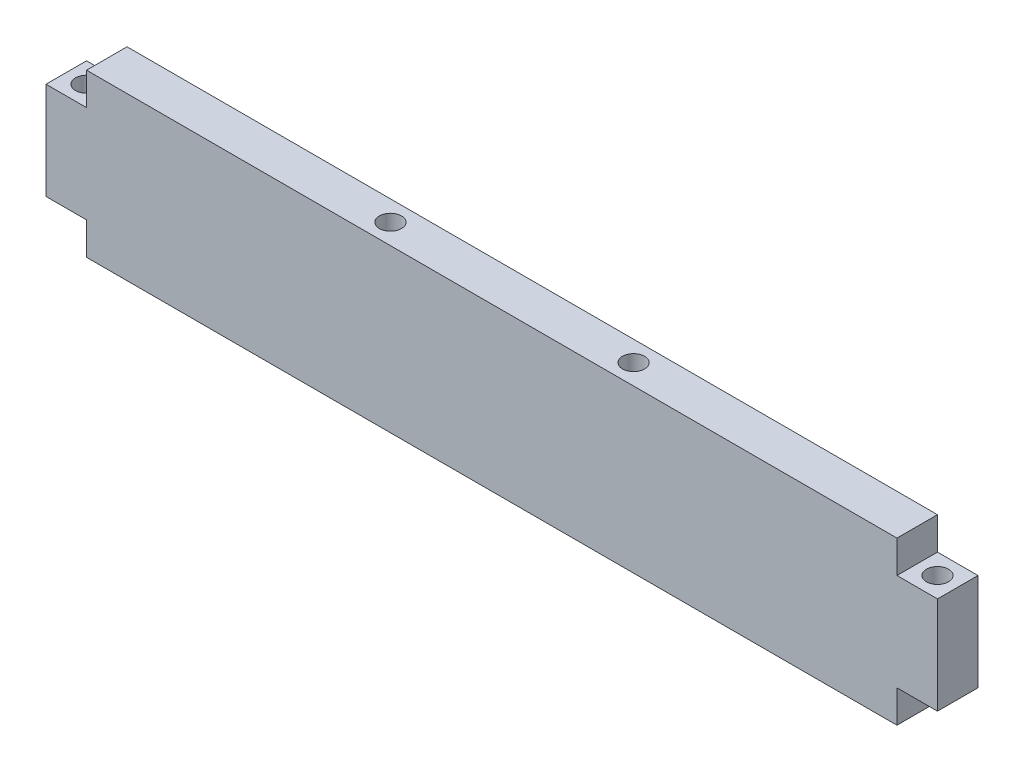
from build123d import *

# Parameters (mm, degrees)
SKETCH1_W                          = 139.7
SKETCH1_H                          = 25.4
BOSS_EXTRUDE1_DEPTH                = 3.175
CUT_EXTRUDE1_REACH                 = 73.279
SKETCH2_W                          = 6.35
SKETCH2_H                          = 5.08
TAP_DRILL_FOR_8_32_TAP1_AT_2_COUNT = 2
TAP_DRILL_FOR_8_32_TAP1_AT_2_PITCH = 47.625
TAP_DRILL_FOR_8_32_TAP1_AT_3_COUNT = 2
TAP_DRILL_FOR_8_32_TAP1_AT_3_PITCH = 85.725
TAP_DRILL_FOR_8_32_TAP1_AT_4_COUNT = 2
TAP_DRILL_FOR_8_32_TAP1_AT_4_PITCH = 133.35


with BuildPart() as part:
    # Sketch1 → Boss-Extrude1 (new, symmetric)
    with BuildSketch(Plane.XY):
        Rectangle(SKETCH1_W, SKETCH1_H)
    extrude(amount=BOSS_EXTRUDE1_DEPTH, both=True)

    # Sketch2 → Cut-Extrude1 (cut, up to next)
    with BuildSketch(Plane.XY.offset(3.175), mode=Mode.PRIVATE) as cut_extrude1_sk1:
        with Locations((-66.675, 10.16)):
            Rectangle(SKETCH2_W, SKETCH2_H)
    cut_extrude1_tool1 = extrude(cut_extrude1_sk1.sketch, amount=-CUT_EXTRUDE1_REACH, mode=Mode.PRIVATE) & part.part
    # Sketch2 → Cut-Extrude1 (cut, up to next)
    with BuildSketch(Plane.XY.offset(3.175), mode=Mode.PRIVATE) as cut_extrude1_sk2:
        with Locations((-66.675, -10.16)):
            Rectangle(SKETCH2_W, SKETCH2_H)
    cut_extrude1_tool2 = extrude(cut_extrude1_sk2.sketch, amount=-CUT_EXTRUDE1_REACH, mode=Mode.PRIVATE) & part.part
    # Sketch2 → Cut-Extrude1 (cut, up to next)
    with BuildSketch(Plane.XY.offset(3.175), mode=Mode.PRIVATE) as cut_extrude1_sk3:
        with Locations((66.675, 10.16)):
            Rectangle(SKETCH2_W, SKETCH2_H)
    cut_extrude1_tool3 = extrude(cut_extrude1_sk3.sketch, amount=-CUT_EXTRUDE1_REACH, mode=Mode.PRIVATE) & part.part
    # Sketch2 → Cut-Extrude1 (cut, up to next)
    with BuildSketch(Plane.XY.offset(3.175), mode=Mode.PRIVATE) as cut_extrude1_sk4:
        with Locations((66.675, -10.16)):
            Rectangle(SKETCH2_W, SKETCH2_H)
    cut_extrude1_tool4 = extrude(cut_extrude1_sk4.sketch, amount=-CUT_EXTRUDE1_REACH, mode=Mode.PRIVATE) & part.part
    add(cut_extrude1_tool1.solids().sort_by_distance((-66.675, 10.16, 3.175))[0], mode=Mode.SUBTRACT)
    add(cut_extrude1_tool2.solids().sort_by_distance((-66.675, -10.16, 3.175))[0], mode=Mode.SUBTRACT)
    add(cut_extrude1_tool3.solids().sort_by_distance((66.675, 10.16, 3.175))[0], mode=Mode.SUBTRACT)
    add(cut_extrude1_tool4.solids().sort_by_distance((66.675, -10.16, 3.175))[0], mode=Mode.SUBTRACT)

    # Sketch5 → Tap Drill for #8-32 Tap1 (revolve, cut)
    with BuildSketch(Plane(origin=(-66.675, 12.7, 0), x_dir=(0, 0, 1), z_dir=(1, 0, 0))):
        Polygon((0, 0), (0, 13.737806461), (1.7272, 12.7), (1.7272, 0), align=None)
    tap_drill_for_8_32_tap1 = revolve(axis=Axis((-66.675, 19.05, 0), (0, -1, 0)), mode=Mode.SUBTRACT)

    # Tap Drill for #8-32 Tap1 at 2: Tap Drill for #8-32 Tap1 ×2
    with Locations(*[(i * TAP_DRILL_FOR_8_32_TAP1_AT_2_PITCH, 0, 0) for i in range(1, TAP_DRILL_FOR_8_32_TAP1_AT_2_COUNT)]):
        add(tap_drill_for_8_32_tap1, mode=Mode.SUBTRACT)

    # Tap Drill for #8-32 Tap1 at 3: Tap Drill for #8-32 Tap1 ×2
    with Locations(*[(i * TAP_DRILL_FOR_8_32_TAP1_AT_3_PITCH, 0, 0) for i in range(1, TAP_DRILL_FOR_8_32_TAP1_AT_3_COUNT)]):
        add(tap_drill_for_8_32_tap1, mode=Mode.SUBTRACT)

    # Tap Drill for #8-32 Tap1 at 4: Tap Drill for #8-32 Tap1 ×2
    with Locations(*[(i * TAP_DRILL_FOR_8_32_TAP1_AT_4_PITCH, 0, 0) for i in range(1, TAP_DRILL_FOR_8_32_TAP1_AT_4_COUNT)]):
        add(tap_drill_for_8_32_tap1, mode=Mode.SUBTRACT)

    # Mirror1: Tap Drill for #8-32 Tap1 across plane
    add(tap_drill_for_8_32_tap1.mirror(Plane.ZX), mode=Mode.SUBTRACT)

    # Mirror1 copy 1 sketch → Mirror1 copy 1 (revolve, cut)
    with BuildSketch(Plane(origin=(-19.05, -12.7, 0), x_dir=(0, 0, 1), z_dir=(1, 0, 0))):
        Polygon((0, 0), (0, -13.737806461), (1.7272, -12.7), (1.7272, 0), align=None)
    revolve(axis=Axis((-19.05, -19.05, 0), (0, -1, 0)), mode=Mode.SUBTRACT)

    # Mirror1 copy 2 sketch → Mirror1 copy 2 (revolve, cut)
    with BuildSketch(Plane(origin=(19.05, -12.7, 0), x_dir=(0, 0, 1), z_dir=(1, 0, 0))):
        Polygon((0, 0), (0, -13.737806461), (1.7272, -12.7), (1.7272, 0), align=None)
    revolve(axis=Axis((19.05, -19.05, 0), (0, -1, 0)), mode=Mode.SUBTRACT)

    # Mirror1 copy 3 sketch → Mirror1 copy 3 (revolve, cut)
    with BuildSketch(Plane(origin=(66.675, -12.7, 0), x_dir=(0, 0, 1), z_dir=(1, 0, 0))):
        Polygon((0, 0), (0, -13.737806461), (1.7272, -12.7), (1.7272, 0), align=None)
    revolve(axis=Axis((66.675, -19.05, 0), (0, -1, 0)), mode=Mode.SUBTRACT)


solid = part.part
